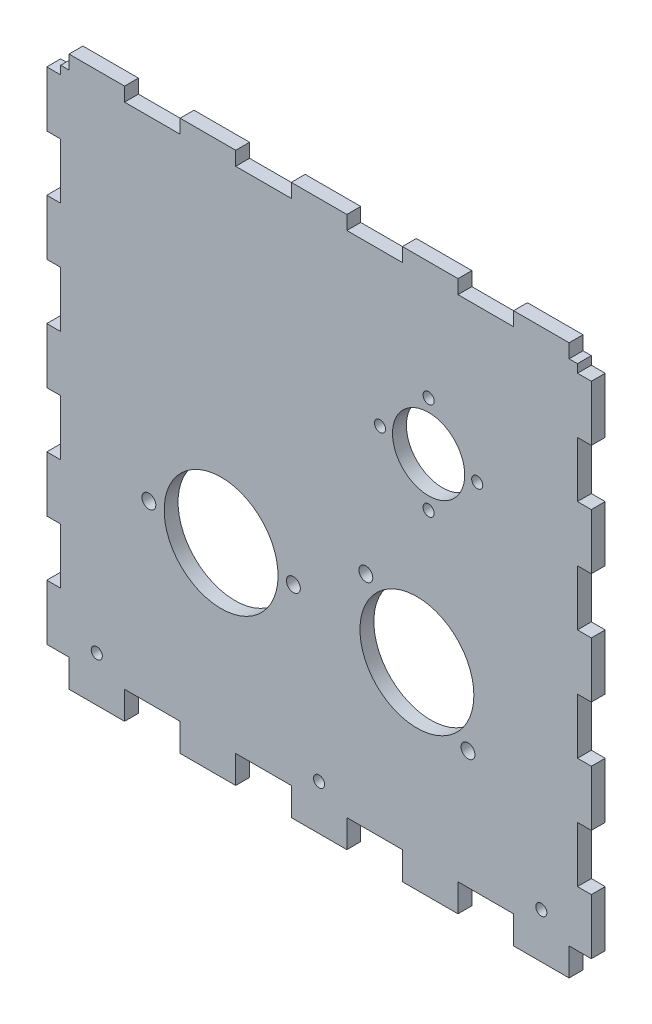
from build123d import *

# Parameters (mm, degrees)
SKETCH_1_W                       = 186
SKETCH_1_H                       = 183
SKETCH_1_R                       = 20.5
SKETCH_1_R_2                     = 2.5
SKETCH_1_R_3                     = 2
SKETCH_1_R_4                     = 13
EXTRUDE_1_DEPTH                  = 5
SKETCH_2_W                       = 5
SKETCH_2_H                       = 20
EXTRUDE_2_DEPTH                  = 5
PATTERN_LINEAR_1_COUNT           = 5
PATTERN_LINEAR_1_PITCH           = 40
MIRROR_1_COPY_1_SKETCH_W         = 5
MIRROR_1_COPY_1_SKETCH_H         = 20
MIRROR_1_COPY_1_DEPTH            = 5
MIRROR_1_COPY_2_SKETCH_W         = 5
MIRROR_1_COPY_2_SKETCH_H         = 20
MIRROR_1_COPY_2_DEPTH            = 5
MIRROR_1_COPY_3_SKETCH_W         = 5
MIRROR_1_COPY_3_SKETCH_H         = 20
MIRROR_1_COPY_3_DEPTH            = 5
MIRROR_1_COPY_4_SKETCH_W         = 5
MIRROR_1_COPY_4_SKETCH_H         = 20
MIRROR_1_COPY_4_DEPTH            = 5
SKETCH_3_W                       = 20
SKETCH_3_H                       = 5
EXTRUDE_3_DEPTH                  = 5
PATTERN_LINEAR_2_COUNT           = 3
PATTERN_LINEAR_2_PITCH           = 40
PATTERN_LINEAR_3_COUNT           = 3
PATTERN_LINEAR_3_PITCH           = 40
SKETCH_4_W                       = 20
SKETCH_4_H                       = 10
EXTRUDE_4_DEPTH                  = 5
PATTERN_LINEAR_4_COUNT           = 3
PATTERN_LINEAR_4_PITCH           = 40
PATTERN_LINEAR_5_COPY_1_SKETCH_W = 20
PATTERN_LINEAR_5_COPY_1_SKETCH_H = 10
PATTERN_LINEAR_5_COPY_1_DEPTH    = 5
PATTERN_LINEAR_5_COPY_2_SKETCH_W = 20
PATTERN_LINEAR_5_COPY_2_SKETCH_H = 10
PATTERN_LINEAR_5_COPY_2_DEPTH    = 5
PATTERN_LINEAR_5_COPY_3_SKETCH_W = 20
PATTERN_LINEAR_5_COPY_3_SKETCH_H = 10
PATTERN_LINEAR_5_COPY_3_DEPTH    = 5
PATTERN_LINEAR_5_COPY_4_SKETCH_W = 20
PATTERN_LINEAR_5_COPY_4_SKETCH_H = 10
PATTERN_LINEAR_5_COPY_4_DEPTH    = 5
PATTERN_LINEAR_5_COPY_5_SKETCH_W = 20
PATTERN_LINEAR_5_COPY_5_SKETCH_H = 10
PATTERN_LINEAR_5_COPY_5_DEPTH    = 5
PATTERN_LINEAR_5_COPY_6_SKETCH_W = 20
PATTERN_LINEAR_5_COPY_6_SKETCH_H = 10
PATTERN_LINEAR_5_COPY_6_DEPTH    = 5
CUT_EXTRUDE_1_REACH              = 143.178
SKETCH_5_R                       = 2
PATTERN_LINEAR_6_COUNT           = 2
PATTERN_LINEAR_6_PITCH           = 80
PATTERN_LINEAR_7_COUNT           = 2
PATTERN_LINEAR_7_PITCH           = 80


with BuildPart() as part:
    # 스케치1 → 보스-돌출1 (new body)
    with BuildSketch(Plane.XY):
        Rectangle(SKETCH_1_W, SKETCH_1_H)
        with Locations((-35.25, -28.5)):
            Circle(SKETCH_1_R, mode=Mode.SUBTRACT)
        with Locations((-61.25, -28.5)):
            Circle(SKETCH_1_R_2, mode=Mode.SUBTRACT)
        with Locations(Location((-9.25, -28.5, 0), (0, 0, 180))):
            Circle(SKETCH_1_R_2, mode=Mode.SUBTRACT)
        with Locations((35.221625496, -30.5)):
            Circle(SKETCH_1_R, mode=Mode.SUBTRACT)
        with Locations((16.836849185, -12.115223689)):
            Circle(SKETCH_1_R_2, mode=Mode.SUBTRACT)
        with Locations((53.606401807, -48.884776311)):
            Circle(SKETCH_1_R_2, mode=Mode.SUBTRACT)
        with Locations((39.42261881, 19)):
            Circle(SKETCH_1_R_3, mode=Mode.SUBTRACT)
        with Locations((39.42261881, 36.5)):
            Circle(SKETCH_1_R_4, mode=Mode.SUBTRACT)
        with Locations((21.92261881, 36.5)):
            Circle(SKETCH_1_R_3, mode=Mode.SUBTRACT)
        with Locations((39.42261881, 54)):
            Circle(SKETCH_1_R_3, mode=Mode.SUBTRACT)
        with Locations((56.92261881, 36.5)):
            Circle(SKETCH_1_R_3, mode=Mode.SUBTRACT)
    extrude(amount=EXTRUDE_1_DEPTH)

    # 스케치2 → 보스-돌출2 (add)
    with BuildSketch(Plane.XY.offset(5)):
        with Locations((-95.5, -81.5)):
            Rectangle(SKETCH_2_W, SKETCH_2_H)
    extrude_2 = extrude(amount=-EXTRUDE_2_DEPTH)

    # 선형 패턴1: 보스-돌출2 ×5
    with Locations(*[(0, i * PATTERN_LINEAR_1_PITCH, 0) for i in range(1, PATTERN_LINEAR_1_COUNT)]):
        add(extrude_2)

    # 대칭 복사1: 보스-돌출2 across plane
    add(extrude_2.mirror(Plane(origin=(0, 0, 0), x_dir=(0, 0, 1), z_dir=(1, 0, 0))))

    # 대칭 복사1 copy 1 sketch → 대칭 복사1 copy 1 (add)
    with BuildSketch(Plane(origin=(0, 40, 5), x_dir=(-1, 0, 0), z_dir=(0, 0, 1))):
        with Locations((-95.5, 81.5)):
            Rectangle(MIRROR_1_COPY_1_SKETCH_W, MIRROR_1_COPY_1_SKETCH_H)
    extrude(amount=-MIRROR_1_COPY_1_DEPTH)

    # 대칭 복사1 copy 2 sketch → 대칭 복사1 copy 2 (add)
    with BuildSketch(Plane(origin=(0, 80, 5), x_dir=(-1, 0, 0), z_dir=(0, 0, 1))):
        with Locations((-95.5, 81.5)):
            Rectangle(MIRROR_1_COPY_2_SKETCH_W, MIRROR_1_COPY_2_SKETCH_H)
    extrude(amount=-MIRROR_1_COPY_2_DEPTH)

    # 대칭 복사1 copy 3 sketch → 대칭 복사1 copy 3 (add)
    with BuildSketch(Plane(origin=(0, 120, 5), x_dir=(-1, 0, 0), z_dir=(0, 0, 1))):
        with Locations((-95.5, 81.5)):
            Rectangle(MIRROR_1_COPY_3_SKETCH_W, MIRROR_1_COPY_3_SKETCH_H)
    extrude(amount=-MIRROR_1_COPY_3_DEPTH)

    # 대칭 복사1 copy 4 sketch → 대칭 복사1 copy 4 (add)
    with BuildSketch(Plane(origin=(0, 160, 5), x_dir=(-1, 0, 0), z_dir=(0, 0, 1))):
        with Locations((-95.5, 81.5)):
            Rectangle(MIRROR_1_COPY_4_SKETCH_W, MIRROR_1_COPY_4_SKETCH_H)
    extrude(amount=-MIRROR_1_COPY_4_DEPTH)

    # 스케치3 → 보스-돌출3 (add)
    with BuildSketch(Plane.XY.offset(5)):
        with Locations((0, 94)):
            Rectangle(SKETCH_3_W, SKETCH_3_H)
    extrude_3 = extrude(amount=-EXTRUDE_3_DEPTH)

    # 선형 패턴2: 보스-돌출3 ×3
    with Locations(*[(i * PATTERN_LINEAR_2_PITCH, 0, 0) for i in range(1, PATTERN_LINEAR_2_COUNT)]):
        add(extrude_3)

    # 선형 패턴3: 보스-돌출3 ×3
    with Locations(*[(-i * PATTERN_LINEAR_3_PITCH, 0, 0) for i in range(1, PATTERN_LINEAR_3_COUNT)]):
        add(extrude_3)

    # 스케치4 → 보스-돌출4 (add)
    with BuildSketch(Plane.XY.offset(5)):
        with Locations((0, -96.5)):
            Rectangle(SKETCH_4_W, SKETCH_4_H)
    extrude_4 = extrude(amount=-EXTRUDE_4_DEPTH)

    # 선형 패턴4: 보스-돌출4 ×3
    with Locations(*[(i * PATTERN_LINEAR_4_PITCH, 0, 0) for i in range(1, PATTERN_LINEAR_4_COUNT)]):
        add(extrude_4)

    # 선형 패턴5 copy 1 sketch → 선형 패턴5 copy 1 (add)
    with BuildSketch(Plane.XY.offset(5)):
        with Locations((0, -96.5)):
            Rectangle(PATTERN_LINEAR_5_COPY_1_SKETCH_W, PATTERN_LINEAR_5_COPY_1_SKETCH_H)
    extrude(amount=-PATTERN_LINEAR_5_COPY_1_DEPTH)

    # 선형 패턴5 copy 2 sketch → 선형 패턴5 copy 2 (add)
    with BuildSketch(Plane(origin=(-40, 0, 5), x_dir=(1, 0, 0), z_dir=(0, 0, 1))):
        with Locations((0, -96.5)):
            Rectangle(PATTERN_LINEAR_5_COPY_2_SKETCH_W, PATTERN_LINEAR_5_COPY_2_SKETCH_H)
    extrude(amount=-PATTERN_LINEAR_5_COPY_2_DEPTH)

    # 선형 패턴5 copy 3 sketch → 선형 패턴5 copy 3 (add)
    with BuildSketch(Plane(origin=(40, 0, 5), x_dir=(1, 0, 0), z_dir=(0, 0, 1))):
        with Locations((0, -96.5)):
            Rectangle(PATTERN_LINEAR_5_COPY_3_SKETCH_W, PATTERN_LINEAR_5_COPY_3_SKETCH_H)
    extrude(amount=-PATTERN_LINEAR_5_COPY_3_DEPTH)

    # 선형 패턴5 copy 4 sketch → 선형 패턴5 copy 4 (add)
    with BuildSketch(Plane.XY.offset(5)):
        with Locations((0, -96.5)):
            Rectangle(PATTERN_LINEAR_5_COPY_4_SKETCH_W, PATTERN_LINEAR_5_COPY_4_SKETCH_H)
    extrude(amount=-PATTERN_LINEAR_5_COPY_4_DEPTH)

    # 선형 패턴5 copy 5 sketch → 선형 패턴5 copy 5 (add)
    with BuildSketch(Plane(origin=(-40, 0, 5), x_dir=(1, 0, 0), z_dir=(0, 0, 1))):
        with Locations((0, -96.5)):
            Rectangle(PATTERN_LINEAR_5_COPY_5_SKETCH_W, PATTERN_LINEAR_5_COPY_5_SKETCH_H)
    extrude(amount=-PATTERN_LINEAR_5_COPY_5_DEPTH)

    # 선형 패턴5 copy 6 sketch → 선형 패턴5 copy 6 (add)
    with BuildSketch(Plane(origin=(-80, 0, 5), x_dir=(1, 0, 0), z_dir=(0, 0, 1))):
        with Locations((0, -96.5)):
            Rectangle(PATTERN_LINEAR_5_COPY_6_SKETCH_W, PATTERN_LINEAR_5_COPY_6_SKETCH_H)
    extrude(amount=-PATTERN_LINEAR_5_COPY_6_DEPTH)

    # 스케치5 → 컷-돌출1 (cut, up to next)
    with BuildSketch(Plane(origin=(0, 0, 0), x_dir=(-1, 0, 0), z_dir=(0, 0, -1)), mode=Mode.PRIVATE) as cut_extrude_1_sk1:
        with Locations((0, -85.2)):
            Circle(SKETCH_5_R)
    cut_extrude_1_tool1 = extrude(cut_extrude_1_sk1.sketch, amount=-CUT_EXTRUDE_1_REACH, mode=Mode.PRIVATE) & part.part
    cut_extrude_1 = cut_extrude_1_tool1.solids().sort_by_distance((0, -85.2, 0))[0]
    add(cut_extrude_1, mode=Mode.SUBTRACT)

    # 선형 패턴6: 컷-돌출1 ×2
    with Locations(*[(i * PATTERN_LINEAR_6_PITCH, 0, 0) for i in range(1, PATTERN_LINEAR_6_COUNT)]):
        add(cut_extrude_1, mode=Mode.SUBTRACT)

    # 선형 패턴7: 컷-돌출1 ×2
    with Locations(*[(-i * PATTERN_LINEAR_7_PITCH, 0, 0) for i in range(1, PATTERN_LINEAR_7_COUNT)]):
        add(cut_extrude_1, mode=Mode.SUBTRACT)


solid = part.part
